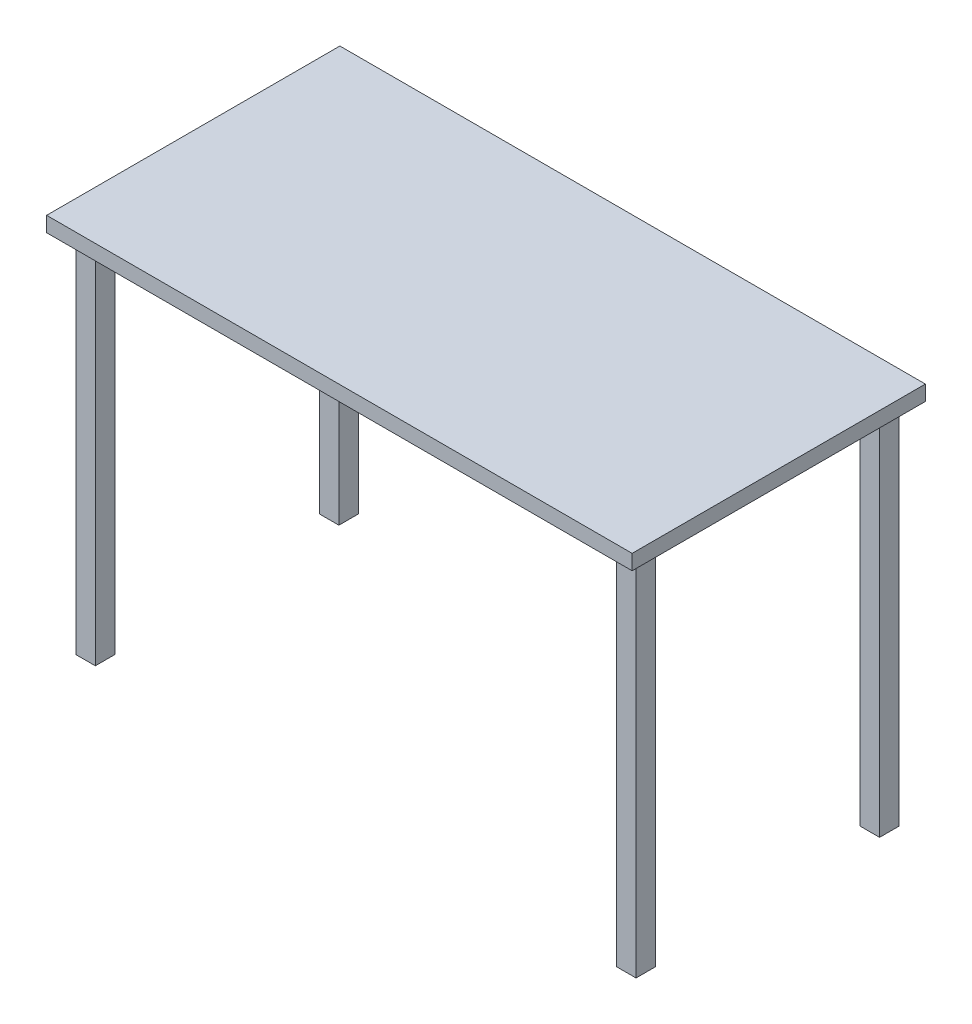
from build123d import *

# Parameters (mm, degrees)
CORTAR_EXTRUIR1_START      = -50
CROQUIS2_R                 = 4.324629937
CORTAR_EXTRUIR1_DEPTH      = 25
CROQUIS3_W                 = 1202
CROQUIS3_H                 = 602
SALIENTE_EXTRUIR1_DEPTH    = 31
CROQUIS4_W                 = 40
CROQUIS4_H                 = 40
SALIENTE_EXTRUIR2_DEPTH    = 750
CORTAR_EXTRUIR2_DEPTH      = 1031.418846877
CORTAR_EXTRUIR2_DEPTH_BACK = 1031.418846877
CROQUIS5_W                 = 169.23973075
CROQUIS5_H                 = 94.141610947


with BuildPart() as part:
    # Croquis1 → Revolución1 (revolve)
    with BuildSketch(Plane.XY, mode=Mode.PRIVATE) as revoluci_n1_sk:
        Polygon((0, 0), (0, 80), (-58, 80), (-58, 31.455108359), (-67.5, 0), align=None)
    revolve(revoluci_n1_sk.sketch.rotate(Axis((0, 0, 0), (0, 1, 0)), 180), axis=Axis((0, 0, 0), (0, 1, 0)))

    # Croquis2 → Cortar-Extruir1 (cut)
    with BuildSketch(Plane(origin=(0, 80, 0), x_dir=(1, 0, 0), z_dir=(0, 1, 0)).offset(CORTAR_EXTRUIR1_START)):
        with Locations((0, 63.025248345)):
            Circle(CROQUIS2_R)
        with Locations((63.025248345, 0)):
            Circle(CROQUIS2_R)
        with Locations((0, -63.025248345)):
            Circle(CROQUIS2_R)
        with Locations((-63.025248345, 0)):
            Circle(CROQUIS2_R)
    extrude(amount=-CORTAR_EXTRUIR1_DEPTH, mode=Mode.SUBTRACT)

    # Croquis3 → Saliente-Extruir1 (add)
    with BuildSketch(Plane.XZ):
        Rectangle(CROQUIS3_W, CROQUIS3_H)
    extrude(amount=SALIENTE_EXTRUIR1_DEPTH)

    # Croquis4 → Saliente-Extruir2 (add)
    with BuildSketch(Plane.XZ.offset(31)):
        with Locations((-551, 251)):
            Rectangle(CROQUIS4_W, CROQUIS4_H)
        with Locations((559, 251)):
            Rectangle(CROQUIS4_W, CROQUIS4_H)
        with Locations((559, -249)):
            Rectangle(CROQUIS4_W, CROQUIS4_H)
        with Locations((-551, -249)):
            Rectangle(CROQUIS4_W, CROQUIS4_H)
    extrude(amount=SALIENTE_EXTRUIR2_DEPTH)

    # Croquis5 → Cortar-Extruir2 (cut, two sides: drawn at the far end of the back side and taken through both)
    with BuildSketch(Plane.XY.offset(-CORTAR_EXTRUIR2_DEPTH_BACK)):
        with Locations((-9.450479153, 47.070805474)):
            Rectangle(CROQUIS5_W, CROQUIS5_H)
    extrude(amount=CORTAR_EXTRUIR2_DEPTH + CORTAR_EXTRUIR2_DEPTH_BACK, mode=Mode.SUBTRACT)


solid = part.part
